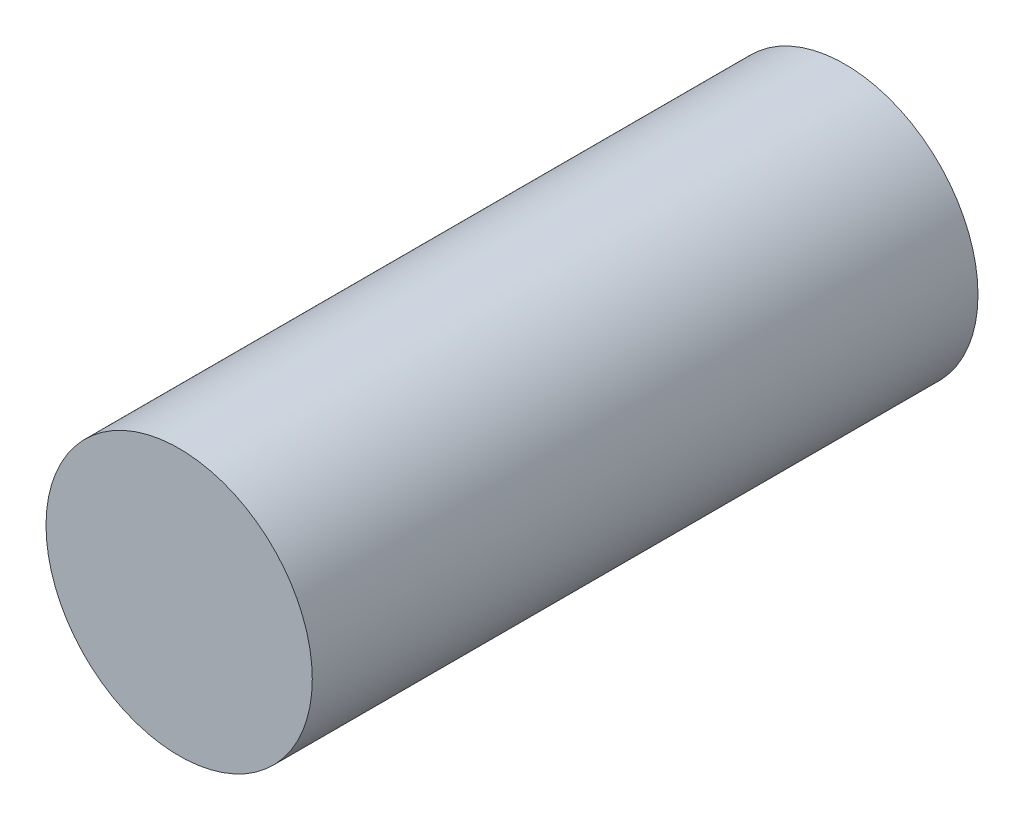
from build123d import *

# Parameters (mm, degrees)
SKETCH1_R           = 20
BOSS_EXTRUDE1_DEPTH = 100


with BuildPart() as part:
    # Sketch1 → Boss-Extrude1 (new body)
    with BuildSketch(Plane.XY):
        Circle(SKETCH1_R)
    extrude(amount=BOSS_EXTRUDE1_DEPTH)


solid = part.part
